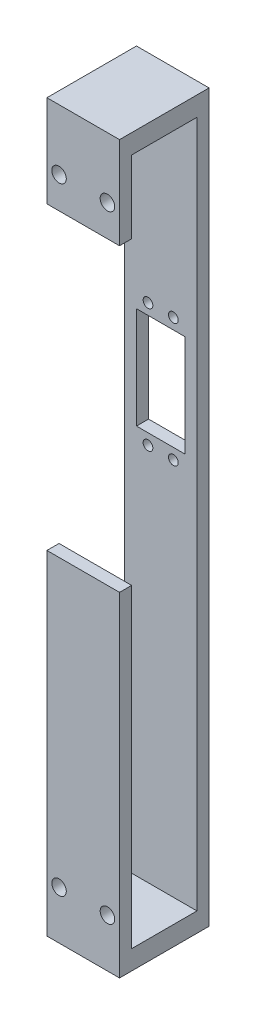
from build123d import *

# Parameters (mm, degrees)
SKETCH_2_W          = 30
SKETCH_2_H          = 60
SKETCH_2_W_2        = 20
SKETCH_2_H_2        = 40
EXTRUDE_1_DEPTH     = 5
SKETCH_3_R          = 2
CUT_EXTRUDE_1_DEPTH = 5
EXTRUDE_2_DEPTH     = 5
SKETCH_6_R          = 1.5
CUT_EXTRUDE_2_DEPTH = 5
SKETCH_7_W          = 5
SKETCH_7_H          = 10
CUT_EXTRUDE_3_DEPTH = 100
SKETCH_8_W          = 30
SKETCH_8_H          = 5
EXTRUDE_3_DEPTH     = 80
SKETCH_9_W          = 30
SKETCH_9_H          = 5
EXTRUDE_4_DEPTH     = 60
SKETCH_11_W         = 30
SKETCH_11_H         = 8
EXTRUDE_5_DEPTH     = 32
EXTRUDE_6_DEPTH     = 30
SKETCH_14_W         = 30
SKETCH_14_H         = 5
EXTRUDE_7_DEPTH     = 30
SKETCH_15_W         = 37
SKETCH_15_H         = 100
EXTRUDE_8_DEPTH     = 30
SKETCH_12_R         = 3
CUT_EXTRUDE_5_DEPTH = 50
SKETCH_16_W         = 27
SKETCH_16_H         = 100
CUT_EXTRUDE_6_DEPTH = 30
SKETCH_17_R         = 3
CUT_EXTRUDE_7_DEPTH = 30
SKETCH_18_W         = 20
SKETCH_18_H         = 1
CUT_EXTRUDE_8_DEPTH = 10


with BuildPart() as part:
    # 草图2 → 凸台-拉伸1 (new body)
    with BuildSketch(Plane.XY):
        with Locations((10, -20)):
            Rectangle(SKETCH_2_W, SKETCH_2_H)
        with Locations((10, -20)):
            Rectangle(SKETCH_2_W_2, SKETCH_2_H_2, mode=Mode.SUBTRACT)
    extrude(amount=EXTRUDE_1_DEPTH)

    # 草图3 → 切除-拉伸1 (cut)
    with BuildSketch(Plane.XY.offset(5)):
        with Locations((15.25, 5.5)):
            Circle(SKETCH_3_R)
        with Locations((15.25, -45.5)):
            Circle(SKETCH_3_R)
        with Locations((4.75, -45.5)):
            Circle(SKETCH_3_R)
        with Locations((4.75, 5.5)):
            Circle(SKETCH_3_R)
    extrude(amount=-CUT_EXTRUDE_1_DEPTH, mode=Mode.SUBTRACT)

    # 草图5 → 凸台-拉伸2 (add)
    with BuildSketch(Plane(origin=(25, 0, 0), x_dir=(0, 0, -1), z_dir=(1, 0, 0))):
        with BuildLine():
            Line((-5, -42), (-5, -40))
            Line((-5, -40), (0, -40))
            Line((0, -40), (0, -42))
            ThreePointArc((0, -42), (0.878679656, -44.121320344), (3, -45))
            Line((3, -45), (20, -45))
            Line((20, -45), (20, -50))
            Line((20, -50), (0, -50))
            Line((0, -50), (-5, -50))
            Line((-5, -50), (-25, -50))
            Line((-25, -50), (-25, -45))
            Line((-25, -45), (-8, -45))
            ThreePointArc((-8, -45), (-5.878679656, -44.121320344), (-5, -42))
        make_face()
    extrude_2 = extrude(amount=EXTRUDE_2_DEPTH)

    # 镜向1: 凸台-拉伸2 across plane
    add(extrude_2.mirror(Plane(origin=(10, 0, 0), x_dir=(0, 0, 1), z_dir=(1, 0, 0))))

    # 草图6 → 切除-拉伸2 (cut)
    with BuildSketch(Plane(origin=(0, -45, 0), x_dir=(1, 0, 0), z_dir=(0, 1, 0))):
        with Locations((-7.5, 12.5)):
            Circle(SKETCH_6_R)
        with Locations((-7.5, -17.5)):
            Circle(SKETCH_6_R)
        with Locations((27.5, -17.5)):
            Circle(SKETCH_6_R)
        with Locations((27.5, 12.5)):
            Circle(SKETCH_6_R)
    extrude(amount=-CUT_EXTRUDE_2_DEPTH, mode=Mode.SUBTRACT)

    # 草图7 → 切除-拉伸3 (cut)
    with BuildSketch(Plane.XY.offset(25)):
        with Locations((27.5, -45)):
            Rectangle(SKETCH_7_W, SKETCH_7_H)
        with Locations((-7.5, -45)):
            Rectangle(SKETCH_7_W, SKETCH_7_H)
    extrude(amount=-CUT_EXTRUDE_3_DEPTH, mode=Mode.SUBTRACT)

    # 草图8 → 凸台-拉伸3 (add)
    with BuildSketch(Plane(origin=(0, 10, 0), x_dir=(1, 0, 0), z_dir=(0, 1, 0))):
        with Locations((10, -2.5)):
            Rectangle(SKETCH_8_W, SKETCH_8_H)
    extrude(amount=EXTRUDE_3_DEPTH)

    # 草图9 → 凸台-拉伸4 (add)
    with BuildSketch(Plane.XZ.offset(50)):
        with Locations((10, 2.5)):
            Rectangle(SKETCH_9_W, SKETCH_9_H)
    extrude(amount=EXTRUDE_4_DEPTH)

    # 草图11 → 凸台-拉伸5 (add)
    with BuildSketch(Plane.XY.offset(5)):
        with Locations((10, -106)):
            Rectangle(SKETCH_11_W, SKETCH_11_H)
        with Locations((10, 86)):
            Rectangle(SKETCH_11_W, SKETCH_11_H)
    extrude(amount=EXTRUDE_5_DEPTH)

    # 草图13 → 凸台-拉伸6 (add)
    with BuildSketch(Plane(origin=(0, -102, 0), x_dir=(1, 0, 0), z_dir=(0, 1, 0))):
        Polygon((-5, -37), (25, -37), (25, -34.408335309), (25, -32), (-5, -32), align=None)
    extrude(amount=EXTRUDE_6_DEPTH)

    # 草图14 → 凸台-拉伸7 (add)
    with BuildSketch(Plane.XZ.offset(-82)):
        with Locations((10, 34.5)):
            Rectangle(SKETCH_14_W, SKETCH_14_H)
    extrude(amount=EXTRUDE_7_DEPTH)

    # 草图15 → 凸台-拉伸8 (add)
    with BuildSketch(Plane.ZY.offset(5)):
        with Locations((18.5, -160)):
            Rectangle(SKETCH_15_W, SKETCH_15_H)
    extrude(amount=-EXTRUDE_8_DEPTH)

    # 草图12 → 切除-拉伸5 (cut)
    with BuildSketch(Plane.XY.offset(5)):
        with Locations((0, 65)):
            Circle(SKETCH_12_R)
        with Locations((20, 65)):
            Circle(SKETCH_12_R)
    extrude(amount=CUT_EXTRUDE_5_DEPTH, mode=Mode.SUBTRACT)

    # 草图16 → 切除-拉伸6 (cut)
    with BuildSketch(Plane(origin=(25, 0, 0), x_dir=(0, 0, -1), z_dir=(1, 0, 0))):
        with Locations((-18.5, -152)):
            Rectangle(SKETCH_16_W, SKETCH_16_H)
    extrude(amount=-CUT_EXTRUDE_6_DEPTH, mode=Mode.SUBTRACT)

    # 草图17 → 切除-拉伸7 (cut)
    with BuildSketch(Plane.XY.offset(37)):
        with Locations((20, -190)):
            Circle(SKETCH_17_R)
        with Locations((0, -190)):
            Circle(SKETCH_17_R)
    extrude(amount=-CUT_EXTRUDE_7_DEPTH, mode=Mode.SUBTRACT)

    # 草图18 → 切除-拉伸8 (cut)
    with BuildSketch(Plane(origin=(0, 0, 0), x_dir=(-1, 0, 0), z_dir=(0, 0, -1))):
        with Locations((-10, -40.5)):
            Rectangle(SKETCH_18_W, SKETCH_18_H)
        with Locations((-10, 0.5)):
            Rectangle(SKETCH_18_W, SKETCH_18_H)
    extrude(amount=-CUT_EXTRUDE_8_DEPTH, mode=Mode.SUBTRACT)


solid = part.part
